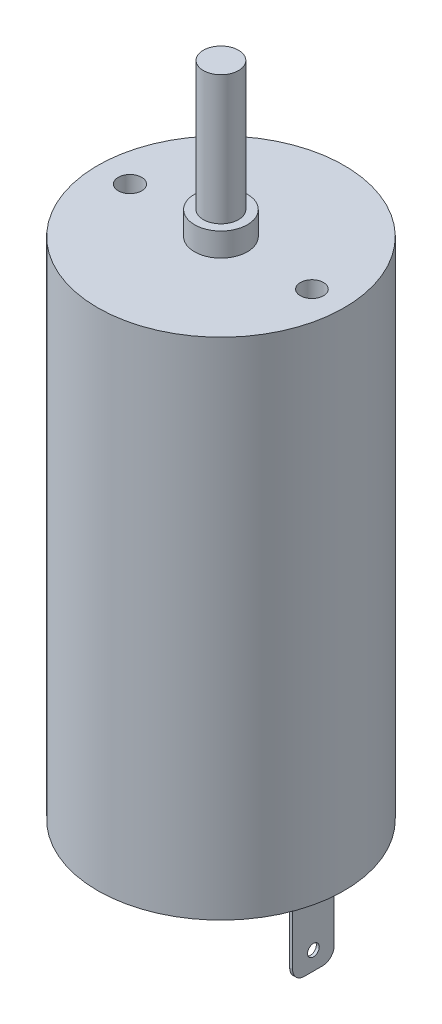
from build123d import *

# Parameters (mm, degrees)
SKETCH1_R           = 10.5
BOSS_EXTRUDE1_DEPTH = 43
SKETCH2_R           = 1.5
BOSS_EXTRUDE2_DEPTH = 13
SKETCH3_R           = 2.25
BOSS_EXTRUDE3_DEPTH = 2
SKETCH4_R           = 0.98394946
SKETCH4_R_2         = 1
CUT_EXTRUDE1_DEPTH  = 7.5
SKETCH5_W           = 0.25
SKETCH5_H           = 4
BOSS_EXTRUDE4_DEPTH = 1.25
SKETCH6_W           = 0.25
SKETCH6_H           = 3.55
BOSS_EXTRUDE5_DEPTH = 6
FILLET1_R           = 1
SKETCH7_R           = 0.5
CUT_EXTRUDE2_DEPTH  = 2
SKETCH8_W           = 0.25
SKETCH8_H           = 3.54
BOSS_EXTRUDE6_DEPTH = 6
FILLET2_R           = 1
SKETCH9_R           = 0.5
CUT_EXTRUDE3_DEPTH  = 3


with BuildPart() as part:
    # Sketch1 → Boss-Extrude1 (new body)
    with BuildSketch(Plane(origin=(0, 0, 0), x_dir=(1, 0, 0), z_dir=(0, 1, 0))):
        with Locations(Location((0, 0, 0), (0, 0, 270))):
            Circle(SKETCH1_R)
    extrude(amount=BOSS_EXTRUDE1_DEPTH)

    # Sketch2 → Boss-Extrude2 (add)
    with BuildSketch(Plane(origin=(0, 43, 0), x_dir=(1, 0, 0), z_dir=(0, 1, 0))):
        with Locations(Location((0, 0, 0), (0, 0, 90))):
            Circle(SKETCH2_R)
    extrude(amount=BOSS_EXTRUDE2_DEPTH)

    # Sketch3 → Boss-Extrude3 (add)
    with BuildSketch(Plane(origin=(0, 43, 0), x_dir=(1, 0, 0), z_dir=(0, 1, 0))):
        with Locations(Location((0, 0, 0), (0, 0, 270))):
            Circle(SKETCH3_R)
    extrude(amount=BOSS_EXTRUDE3_DEPTH)

    # Sketch4 → Cut-Extrude1 (cut)
    with BuildSketch(Plane(origin=(0, 43, 0), x_dir=(1, 0, 0), z_dir=(0, 1, 0))):
        with Locations(Location((7.75, 0, 0), (0, 0, 270))):
            Circle(SKETCH4_R)
        with Locations(Location((-7.75, 0, 0), (0, 0, 270))):
            Circle(SKETCH4_R_2)
    extrude(amount=-CUT_EXTRUDE1_DEPTH, mode=Mode.SUBTRACT)

    # Sketch5 → Boss-Extrude4 (add)
    with BuildSketch(Plane.XZ):
        with Locations((7.75, 0)):
            Rectangle(SKETCH5_W, SKETCH5_H)
        with Locations((-7.75, 0)):
            Rectangle(SKETCH5_W, SKETCH5_H)
    extrude(amount=BOSS_EXTRUDE4_DEPTH)

    # Sketch6 → Boss-Extrude5 (add)
    with BuildSketch(Plane.XZ.offset(1.25)):
        with Locations((-7.75, 0)):
            Rectangle(SKETCH6_W, SKETCH6_H)
    extrude(amount=BOSS_EXTRUDE5_DEPTH)

    # Fillet1
    fillet1_edges = [part.edges().sort_by_distance(p)[0] for p in [
        (-7.75, -7.25, 1.775),
        (-7.75, -7.25, -1.775),
    ]]
    fillet(fillet1_edges, radius=FILLET1_R)

    # Sketch7 → Cut-Extrude2 (cut)
    with BuildSketch(Plane.ZY.offset(7.875)):
        with Locations((0, -5.696270768)):
            Circle(SKETCH7_R)
    extrude(amount=-CUT_EXTRUDE2_DEPTH, mode=Mode.SUBTRACT)

    # Sketch8 → Boss-Extrude6 (add)
    with BuildSketch(Plane.XZ.offset(1.25)):
        with Locations((7.75, 0)):
            Rectangle(SKETCH8_W, SKETCH8_H)
    extrude(amount=BOSS_EXTRUDE6_DEPTH)

    # Fillet2
    fillet2_edges = [part.edges().sort_by_distance(p)[0] for p in [
        (7.75, -7.25, -1.77),
        (7.75, -7.25, 1.77),
    ]]
    fillet(fillet2_edges, radius=FILLET2_R)

    # Sketch9 → Cut-Extrude3 (cut)
    with BuildSketch(Plane(origin=(7.875, 0, 0), x_dir=(0, 0, -1), z_dir=(1, 0, 0))):
        with Locations((0, -5.7)):
            Circle(SKETCH9_R)
    extrude(amount=-CUT_EXTRUDE3_DEPTH, mode=Mode.SUBTRACT)


solid = part.part
